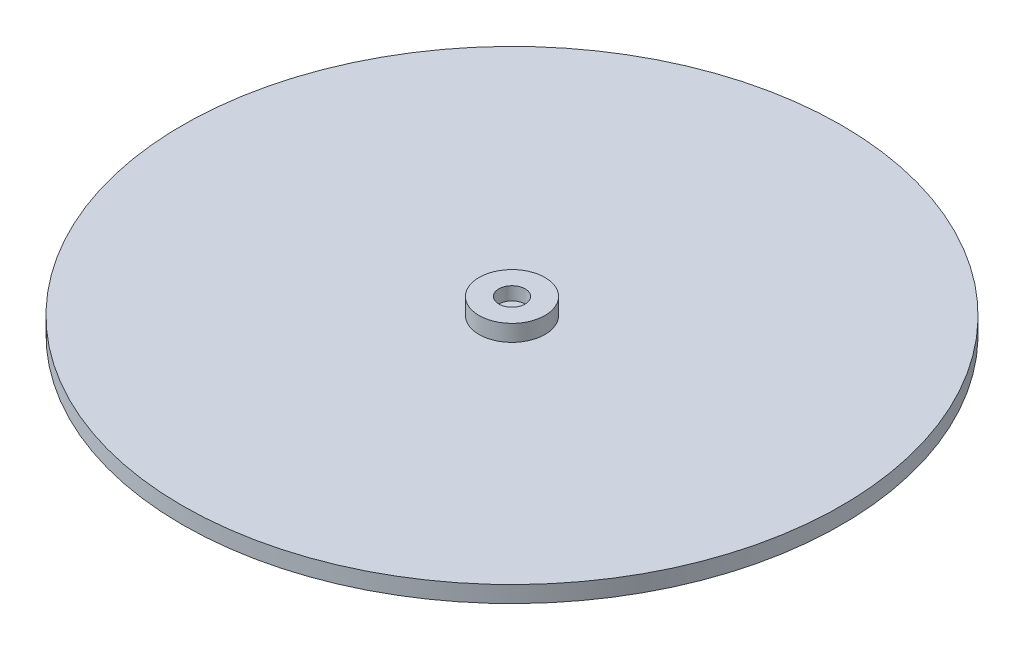
from build123d import *

# Parameters (mm, degrees)
SKETCH1_R           = 500
BOSS_EXTRUDE1_DEPTH = 25
SKETCH2_R           = 50
BOSS_EXTRUDE2_DEPTH = 25
SKETCH3_R           = 20
CUT_EXTRUDE1_DEPTH  = 20


with BuildPart() as part:
    # Sketch1 → Boss-Extrude1 (new body)
    with BuildSketch(Plane(origin=(0, 0, 0), x_dir=(1, 0, 0), z_dir=(0, 1, 0))):
        with Locations(Location((0, 0, 0), (0, 0, 270))):
            Circle(SKETCH1_R)
    extrude(amount=BOSS_EXTRUDE1_DEPTH)

    # Sketch2 → Boss-Extrude2 (add)
    with BuildSketch(Plane(origin=(0, 25, 0), x_dir=(1, 0, 0), z_dir=(0, 1, 0))):
        with Locations(Location((0, 0, 0), (0, 0, 270))):
            Circle(SKETCH2_R)
    extrude(amount=BOSS_EXTRUDE2_DEPTH)

    # Sketch3 → Cut-Extrude1 (cut)
    with BuildSketch(Plane(origin=(0, 50, 0), x_dir=(1, 0, 0), z_dir=(0, 1, 0))):
        with Locations(Location((0, 0, 0), (0, 0, 270))):
            Circle(SKETCH3_R)
    extrude(amount=-CUT_EXTRUDE1_DEPTH, mode=Mode.SUBTRACT)


solid = part.part
